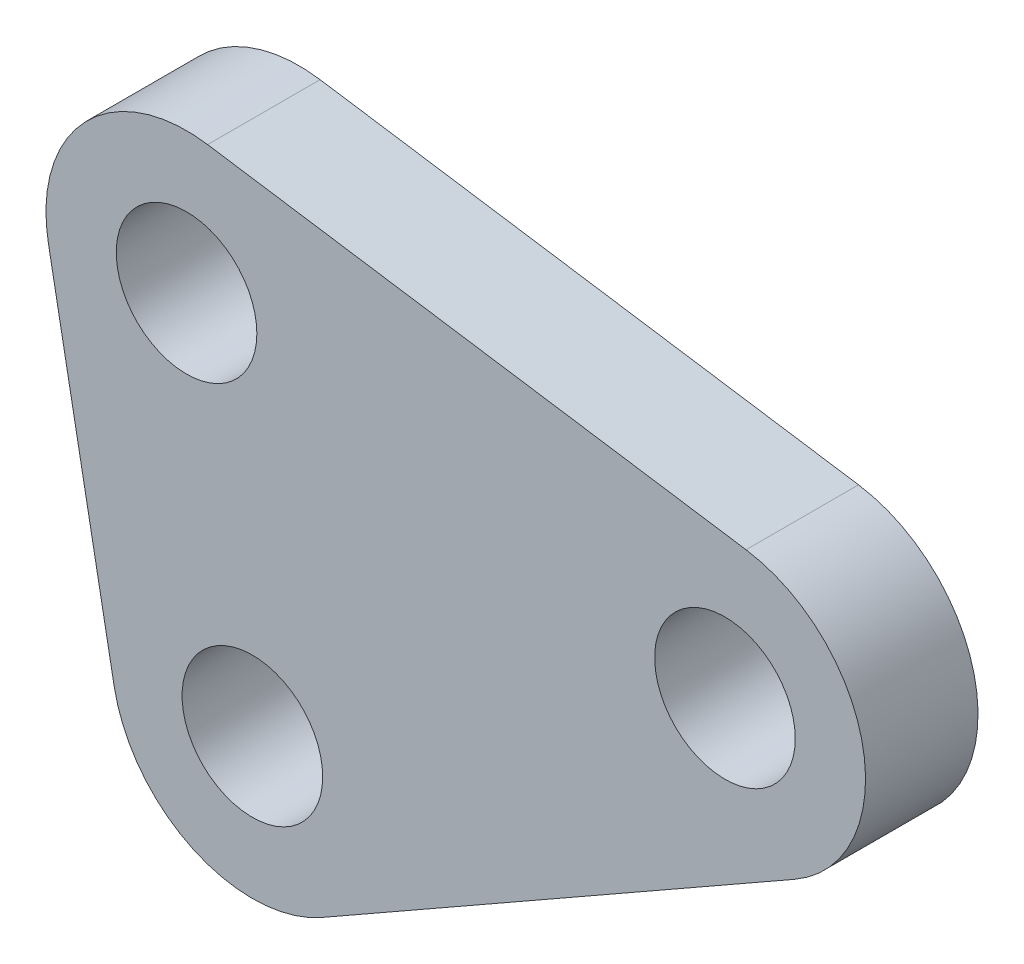
from build123d import *

# Parameters (mm, degrees)
SKETCH1_R           = 2.5
BOSS_EXTRUDE1_DEPTH = 4


with BuildPart() as part:
    # Sketch1 → Boss-Extrude1 (new body)
    with BuildSketch(Plane.XY):
        with BuildLine():
            Line((26.891590001, 77.042584155), (46.037988185, 74.138222759))
            ThreePointArc((46.037988185, 74.138222759), (50.20397723, 70.108121575), (47.763588686, 64.850585648))
            Line((47.763588686, 64.850585648), (30.958043521, 55.274150009))
            ThreePointArc((30.958043521, 55.274150009), (26.381296021, 55.081304051), (23.568249259, 58.696629092))
            Line((23.568249259, 58.696629092), (21.227396241, 71.177426126))
            ThreePointArc((21.227396241, 71.177426126), (22.54509271, 75.572516008), (26.891590001, 77.042584155))
        make_face()
        with Locations((26.141706988, 72.099136424)):
            Circle(SKETCH1_R, mode=Mode.SUBTRACT)
        with Locations((28.482560007, 59.618339389)):
            Circle(SKETCH1_R, mode=Mode.SUBTRACT)
        with Locations((45.288105172, 69.194775028)):
            Circle(SKETCH1_R, mode=Mode.SUBTRACT)
    extrude(amount=BOSS_EXTRUDE1_DEPTH)


solid = part.part
